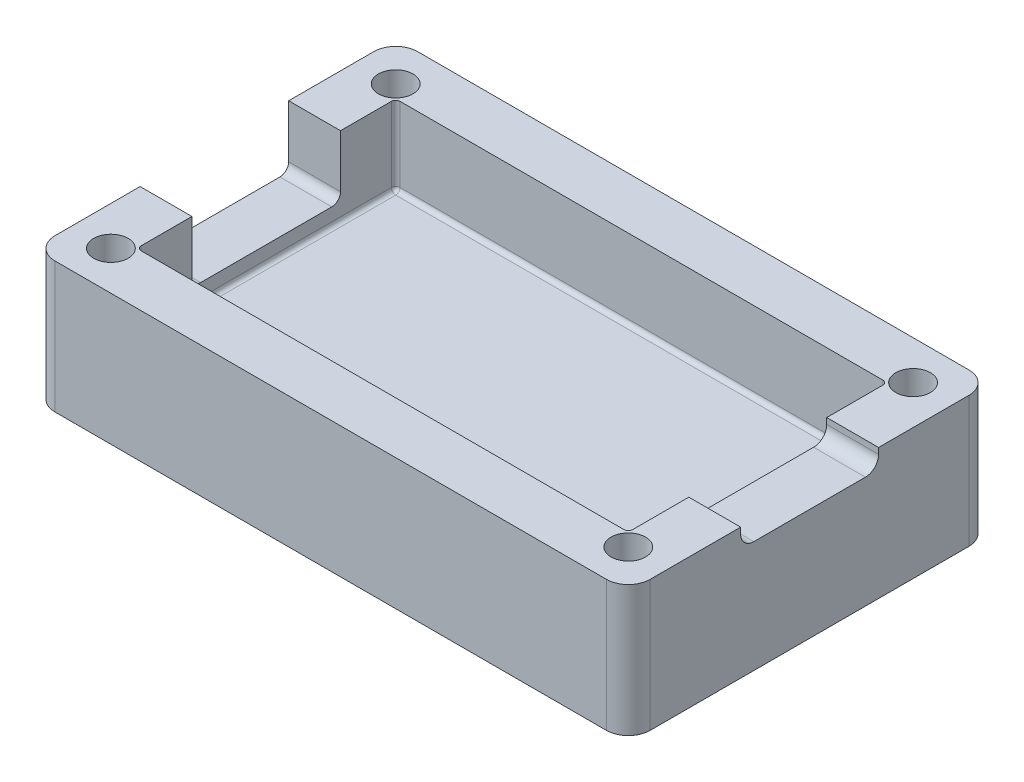
from build123d import *

# Parameters (mm, degrees)
SKETCH1_W           = 34.447999938
SKETCH1_H           = 20.985999938
BOSS_EXTRUDE1_DEPTH = 7.572
SKETCH3_W           = 28.448
SKETCH3_H           = 14.986
CUT_EXTRUDE1_DEPTH  = 4.572
SKETCH4_R           = 1
CUT_EXTRUDE2_DEPTH  = 6.19
FILLET1_R           = 1.27
FILLET2_R           = 0.254
FILLET3_R           = 0.254
SKETCH5_W           = 8.599089175
SKETCH5_H           = 3.565628699
CUT_EXTRUDE3_DEPTH  = 2.999999969
FILLET4_R           = 0.508
SKETCH7_W           = 7.982788435
SKETCH7_H           = 1.108191991
CUT_EXTRUDE4_DEPTH  = 2.999999969
FILLET5_R           = 0.762


with BuildPart() as part:
    # Sketch1 → Boss-Extrude1 (new body)
    with BuildSketch(Plane(origin=(0, 0, 0), x_dir=(1, 0, 0), z_dir=(0, 1, 0))):
        with Locations((42.705323942, -4.766172171)):
            Rectangle(SKETCH1_W, SKETCH1_H)
    extrude(amount=BOSS_EXTRUDE1_DEPTH)

    # Sketch3 → Cut-Extrude1 (cut)
    with BuildSketch(Plane(origin=(0, 7.572, 0), x_dir=(1, 0, 0), z_dir=(0, 1, 0))):
        with Locations((42.705323942, -4.766172171)):
            Rectangle(SKETCH3_W, SKETCH3_H)
    extrude(amount=-CUT_EXTRUDE1_DEPTH, mode=Mode.SUBTRACT)

    # Sketch4 → Cut-Extrude2 (cut)
    with BuildSketch(Plane(origin=(0, 7.572, 0), x_dir=(1, 0, 0), z_dir=(0, 1, 0))):
        with Locations(Location((57.677427469, 3.474931356, 0), (0, 0, 270))):
            Circle(SKETCH4_R)
        with Locations(Location((57.677427469, -13.007275697, 0), (0, 0, 270))):
            Circle(SKETCH4_R)
        with Locations(Location((27.733220415, -13.007275697, 0), (0, 0, 270))):
            Circle(SKETCH4_R)
        with Locations(Location((27.733220415, 3.474931356, 0), (0, 0, 270))):
            Circle(SKETCH4_R)
    extrude(amount=-CUT_EXTRUDE2_DEPTH, mode=Mode.SUBTRACT)

    # Fillet1
    fillet1_edges = [part.edges().sort_by_distance(p)[0] for p in [
        (25.481323973, 3.786, -5.726827798),
        (59.929323911, 3.786, -5.726827798),
        (59.929323911, 3.786, 15.25917214),
        (25.481323973, 3.786, 15.25917214),
    ]]
    fillet(fillet1_edges, radius=FILLET1_R)

    # Fillet2
    fillet2_edges = [part.edges().sort_by_distance(p)[0] for p in [
        (28.481323942, 5.286, 12.259172171),
        (28.481323942, 5.286, -2.726827829),
        (56.929323942, 5.286, -2.726827829),
        (56.929323942, 5.286, 12.259172171),
    ]]
    fillet(fillet2_edges, radius=FILLET2_R)

    # Fillet3
    fillet3_edges = [part.edges().sort_by_distance(p)[0] for p in [
        (42.705323942, 3, -2.726827829),
        (56.929323942, 3, 4.766172171),
        (28.481323942, 3, 4.766172171),
        (42.705323942, 3, 12.259172171),
        (28.555718819, 3, -2.652432952),
        (28.555718819, 3, 12.184777293),
        (56.854929064, 3, 12.184777293),
        (56.854929064, 3, -2.652432952),
    ]]
    fillet(fillet3_edges, radius=FILLET3_R)

    # Sketch5 → Cut-Extrude3 (cut)
    with BuildSketch(Plane.ZY.offset(-25.481323973)):
        with Locations((4.76617217, 5.789185651)):
            Rectangle(SKETCH5_W, SKETCH5_H)
    extrude(amount=-CUT_EXTRUDE3_DEPTH, mode=Mode.SUBTRACT)

    # Fillet4
    fillet4_edges = [part.edges().sort_by_distance(p)[0] for p in [
        (26.981323957, 4.006371301, 9.065716758),
        (26.981323957, 4.006371301, 0.466627583),
    ]]
    fillet(fillet4_edges, radius=FILLET4_R)

    # Sketch7 → Cut-Extrude4 (cut)
    with BuildSketch(Plane(origin=(59.929323911, 0, 0), x_dir=(0, 0, -1), z_dir=(1, 0, 0))):
        with Locations((-4.766172171, 7.017904005)):
            Rectangle(SKETCH7_W, SKETCH7_H)
    extrude(amount=-CUT_EXTRUDE4_DEPTH, mode=Mode.SUBTRACT)

    # Fillet5
    fillet5_edges = [part.edges().sort_by_distance(p)[0] for p in [
        (58.429323926, 6.463808009, 0.774777953),
        (58.429323926, 6.463808009, 8.757566388),
    ]]
    fillet(fillet5_edges, radius=FILLET5_R)


solid = part.part
